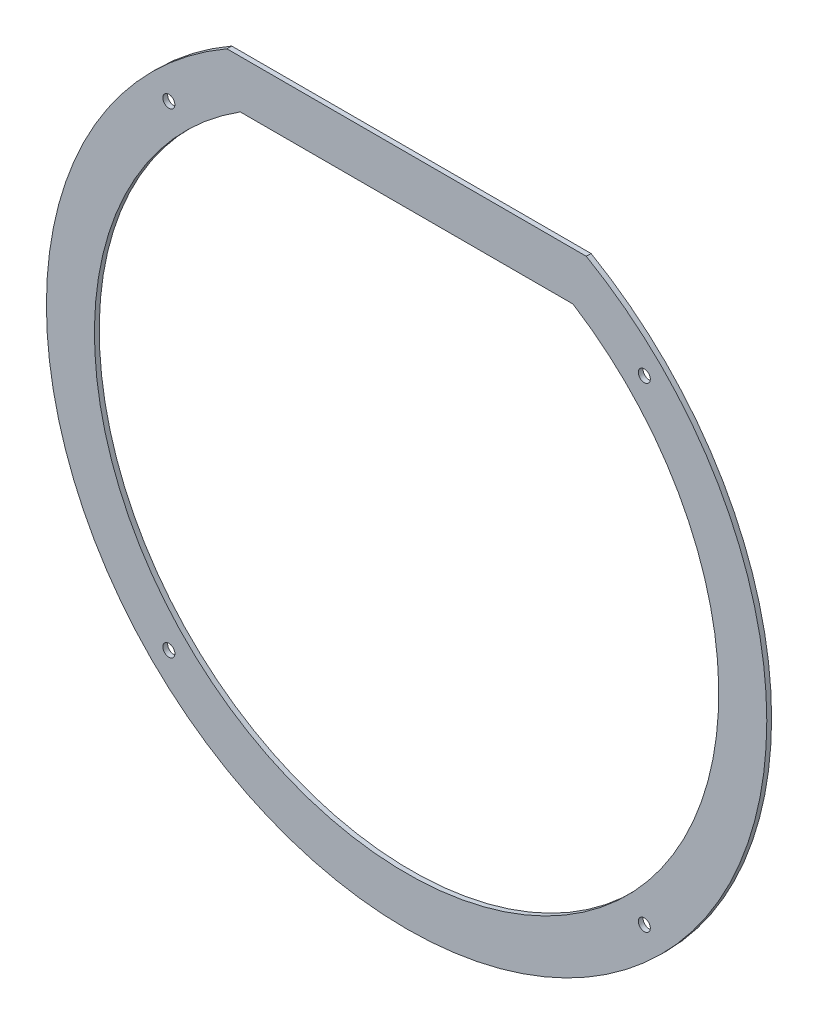
from build123d import *

# Parameters (mm, degrees)
ESQUISSE1_R        = 2.5
BOSS_EXTRU_1_DEPTH = 2


with BuildPart() as part:
    # Esquisse1 → Boss.-Extru.1 (new body)
    with BuildSketch(Plane.XY):
        with BuildLine():
            Line((-74.833147735, 130), (74.833147735, 130))
            ThreePointArc((74.833147735, 130), (0, -150), (-74.833147735, 130))
        make_face()
        with Locations((-98.994949366, 98.994949366)):
            Circle(ESQUISSE1_R, mode=Mode.SUBTRACT)
        with Locations((-98.994949366, -98.994949366)):
            Circle(ESQUISSE1_R, mode=Mode.SUBTRACT)
        with Locations((98.994949366, -98.994949366)):
            Circle(ESQUISSE1_R, mode=Mode.SUBTRACT)
        with Locations((98.994949366, 98.994949366)):
            Circle(ESQUISSE1_R, mode=Mode.SUBTRACT)
        with BuildLine():
            Line((-69.282032303, 110), (69.282032303, 110))
            ThreePointArc((69.282032303, 110), (0, -130), (-69.282032303, 110))
        make_face(mode=Mode.SUBTRACT)
    extrude(amount=BOSS_EXTRU_1_DEPTH)


solid = part.part
